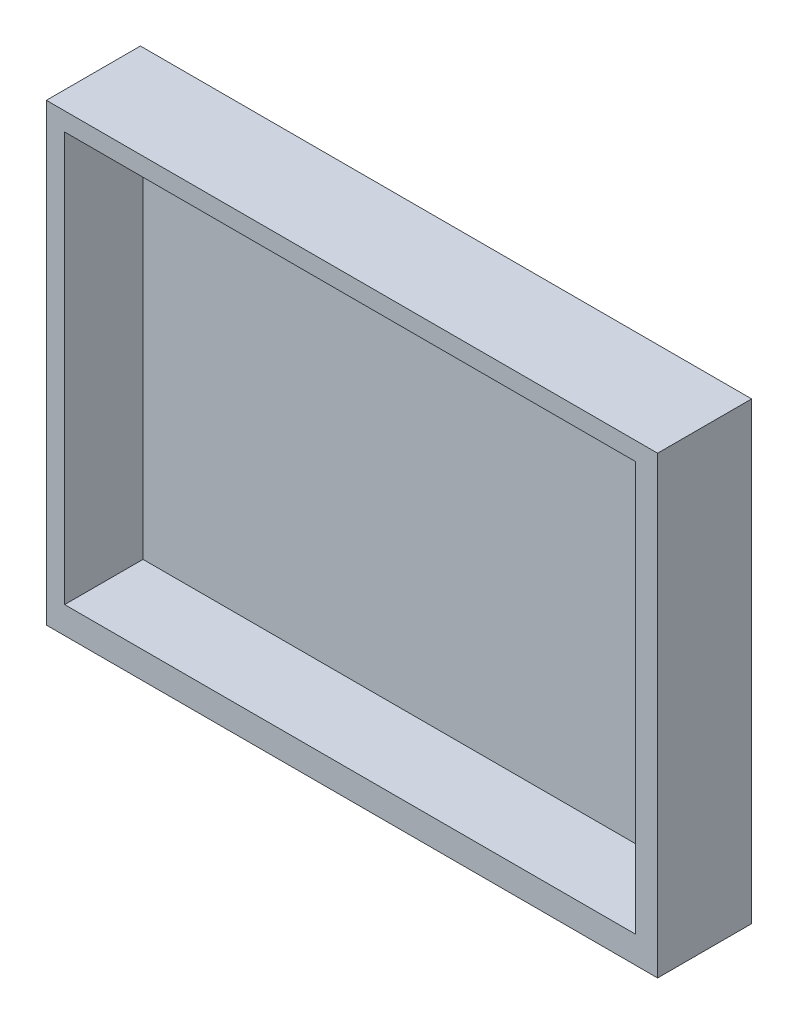
from build123d import *

# Parameters (mm, degrees)
SKETCH_1_W      = 117
SKETCH_1_H      = 87
SKETCH_1_W_2    = 110
SKETCH_1_H_2    = 80
EXTRUDE_1_DEPTH = 3
SKETCH_2_W      = 117
SKETCH_2_H      = 87
SKETCH_2_W_2    = 109.279406394
SKETCH_2_H_2    = 78.35290245
EXTRUDE_2_DEPTH = 15


with BuildPart() as part:
    # 草图1 → 凸台-拉伸1 (new body)
    # profile 1 of 2: a face of its own
    with BuildSketch(Plane.XY):
        with Locations((58.5, -43.5)):
            Rectangle(SKETCH_1_W, SKETCH_1_H)
        with Locations((58.5, -43.5)):
            Rectangle(SKETCH_1_W_2, SKETCH_1_H_2, mode=Mode.SUBTRACT)
    # profile 2 of 2: a face of its own
    with BuildSketch(Plane.XY):
        with Locations((58.5, -43.5)):
            Rectangle(SKETCH_1_W_2, SKETCH_1_H_2)
    extrude(amount=EXTRUDE_1_DEPTH)

    # 草图2 → 凸台-拉伸2 (add)
    with BuildSketch(Plane.XY.offset(3)):
        with Locations((58.5, -43.5)):
            Rectangle(SKETCH_2_W, SKETCH_2_H)
        with Locations((58.139703197, -42.676451225)):
            Rectangle(SKETCH_2_W_2, SKETCH_2_H_2, mode=Mode.SUBTRACT)
    extrude(amount=EXTRUDE_2_DEPTH)


solid = part.part
